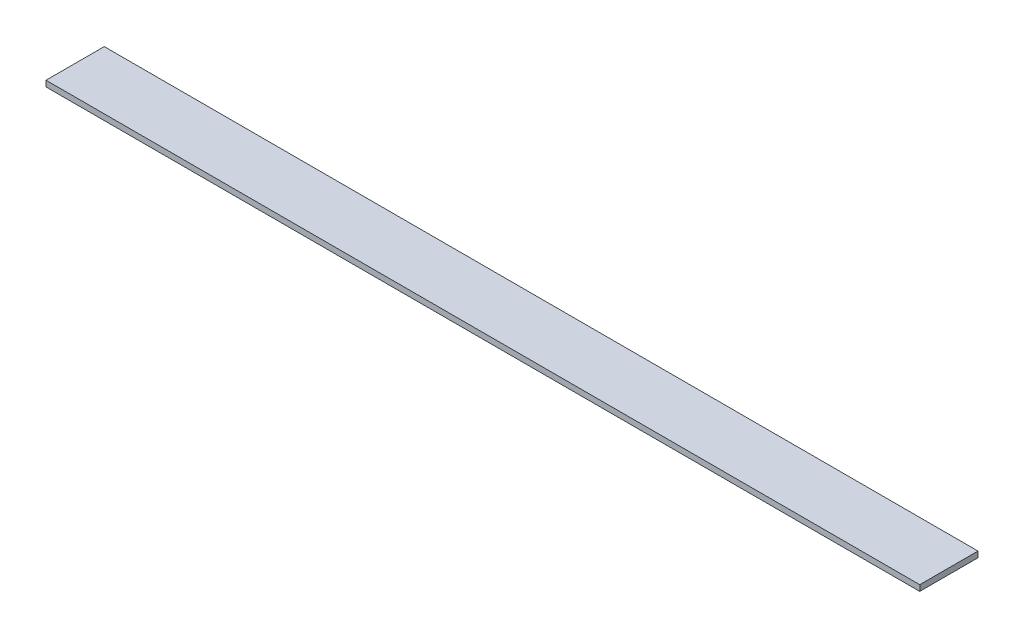
from build123d import *

# Parameters (mm, degrees)
SKETCH1_W           = 25.4
SKETCH1_H           = 2.54
BOSS_EXTRUDE1_DEPTH = 381


with BuildPart() as part:
    # Sketch1 → Boss-Extrude1 (new body)
    with BuildSketch(Plane(origin=(0, 0, 0), x_dir=(0, 0, -1), z_dir=(1, 0, 0))):
        with Locations((12.7, 1.27)):
            Rectangle(SKETCH1_W, SKETCH1_H)
    extrude(amount=BOSS_EXTRUDE1_DEPTH)


solid = part.part
